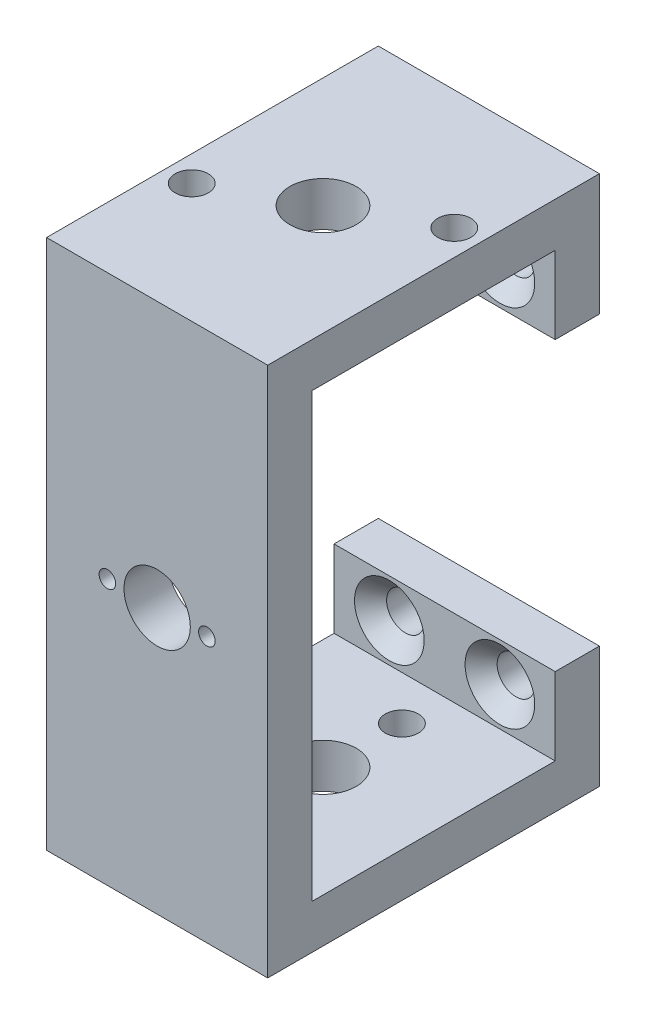
from build123d import *

# Parameters (mm, degrees)
BOSS_EXTRUDE1_DEPTH                             = 20
SKETCH2_R                                       = 3
CUT_EXTRUDE1_DEPTH                              = 48.244047244
SKETCH3_R                                       = 3
CUT_EXTRUDE2_DEPTH                              = 55.120236511
SKETCH4_W                                       = 4
SKETCH4_H                                       = 3
CUT_EXTRUDE3_DEPTH                              = 43.201895692
CUT_EXTRUDE4_REACH                              = 56.12
SKETCH5_R                                       = 1.5
CUT_EXTRUDE5_REACH                              = 56.12
SKETCH6_R                                       = 1.5
CUT_EXTRUDE6_REACH                              = 51.558
SKETCH7_R                                       = 1.5
CSK_FOR_M3_FLAT_HEAD_MACHINE_SCREW1_D           = 3.4
CSK_FOR_M3_FLAT_HEAD_MACHINE_SCREW1_DEPTH       = 4
CSK_FOR_M3_FLAT_HEAD_MACHINE_SCREW1_CSINK_D     = 6.3
CSK_FOR_M3_FLAT_HEAD_MACHINE_SCREW1_CSINK_ANGLE = 90
SKETCH9_R                                       = 0.75
CUT_EXTRUDE7_DEPTH                              = 50.558046773


with BuildPart() as part:
    # Sketch1 → Boss-Extrude1 (new body)
    with BuildSketch(Plane(origin=(0, 0, 0), x_dir=(0, 0, -1), z_dir=(1, 0, 0))):
        Polygon((-15, 0), (-15, 14), (15, 14), (15, 0), (11, 0), (11, 10), (-11, 10), (-11, 0), (-11, -30), (11, -30), (11, -20), (15, -20), (15, -34), (-15, -34), (-15, -20), align=None)
    extrude(amount=BOSS_EXTRUDE1_DEPTH)

    # Sketch2 → Cut-Extrude1 (cut, through all)
    with BuildSketch(Plane(origin=(0, 0, 11), x_dir=(-1, 0, 0), z_dir=(0, 0, -1))):
        with Locations(Location((-10, -10, 0), (0, 0, 90))):
            Circle(SKETCH2_R)
    extrude(amount=-CUT_EXTRUDE1_DEPTH, mode=Mode.SUBTRACT)

    # Sketch3 → Cut-Extrude2 (cut, through all)
    with BuildSketch(Plane(origin=(0, 14, 0), x_dir=(1, 0, 0), z_dir=(0, 1, 0))):
        with Locations(Location((10, 0, 0), (0, 0, 270))):
            Circle(SKETCH3_R)
    extrude(amount=-CUT_EXTRUDE2_DEPTH, mode=Mode.SUBTRACT)

    # Sketch4 → Cut-Extrude3 (cut, through all)
    with BuildSketch(Plane(origin=(20, 0, 0), x_dir=(0, 0, -1), z_dir=(1, 0, 0))):
        with Locations((13, 1.5)):
            Rectangle(SKETCH4_W, SKETCH4_H)
        with Locations((13, -21.5)):
            Rectangle(SKETCH4_W, SKETCH4_H)
    extrude(amount=-CUT_EXTRUDE3_DEPTH, mode=Mode.SUBTRACT)

    # Sketch5 → Cut-Extrude4 (cut, up to next)
    with BuildSketch(Plane.XZ.offset(34), mode=Mode.PRIVATE) as cut_extrude4_sk1:
        with Locations(Location((9.864597697, 6.998690322, 0), (0, 0, 270))):
            Circle(SKETCH5_R)
    cut_extrude4_tool1 = extrude(cut_extrude4_sk1.sketch, amount=-CUT_EXTRUDE4_REACH, mode=Mode.PRIVATE) & part.part
    # Sketch5 → Cut-Extrude4 (cut, up to next)
    with BuildSketch(Plane.XZ.offset(34), mode=Mode.PRIVATE) as cut_extrude4_sk2:
        with Locations(Location((10.135402303, -6.998690322, 0), (0, 0, 270))):
            Circle(SKETCH5_R)
    cut_extrude4_tool2 = extrude(cut_extrude4_sk2.sketch, amount=-CUT_EXTRUDE4_REACH, mode=Mode.PRIVATE) & part.part
    add(cut_extrude4_tool1.solids().sort_by_distance((9.864598, -34, 6.99869))[0], mode=Mode.SUBTRACT)
    add(cut_extrude4_tool2.solids().sort_by_distance((10.135402, -34, -6.99869))[0], mode=Mode.SUBTRACT)

    # Sketch6 → Cut-Extrude5 (cut, up to next)
    with BuildSketch(Plane(origin=(0, 14, 0), x_dir=(1, 0, 0), z_dir=(0, 1, 0)), mode=Mode.PRIVATE) as cut_extrude5_sk1:
        with Locations(Location((17.679589652, 4.193614525, 0), (0, 0, 270))):
            Circle(SKETCH6_R)
    cut_extrude5_tool1 = extrude(cut_extrude5_sk1.sketch, amount=-CUT_EXTRUDE5_REACH, mode=Mode.PRIVATE) & part.part
    # Sketch6 → Cut-Extrude5 (cut, up to next)
    with BuildSketch(Plane(origin=(0, 14, 0), x_dir=(1, 0, 0), z_dir=(0, 1, 0)), mode=Mode.PRIVATE) as cut_extrude5_sk2:
        with Locations(Location((2.320410348, -4.193614525, 0), (0, 0, 270))):
            Circle(SKETCH6_R)
    cut_extrude5_tool2 = extrude(cut_extrude5_sk2.sketch, amount=-CUT_EXTRUDE5_REACH, mode=Mode.PRIVATE) & part.part
    add(cut_extrude5_tool1.solids().sort_by_distance((17.67959, 14, -4.193615))[0], mode=Mode.SUBTRACT)
    add(cut_extrude5_tool2.solids().sort_by_distance((2.32041, 14, 4.193615))[0], mode=Mode.SUBTRACT)

    # Sketch7 → Cut-Extrude6 (cut, up to next)
    with BuildSketch(Plane(origin=(0, 0, -15), x_dir=(-1, 0, 0), z_dir=(0, 0, -1)), mode=Mode.PRIVATE) as cut_extrude6_sk1:
        with Locations((-15, 6.5)):
            Circle(SKETCH7_R)
    cut_extrude6_tool1 = extrude(cut_extrude6_sk1.sketch, amount=-CUT_EXTRUDE6_REACH, mode=Mode.PRIVATE) & part.part
    # Sketch7 → Cut-Extrude6 (cut, up to next)
    with BuildSketch(Plane(origin=(0, 0, -15), x_dir=(-1, 0, 0), z_dir=(0, 0, -1)), mode=Mode.PRIVATE) as cut_extrude6_sk2:
        with Locations((-5, 6.5)):
            Circle(SKETCH7_R)
    cut_extrude6_tool2 = extrude(cut_extrude6_sk2.sketch, amount=-CUT_EXTRUDE6_REACH, mode=Mode.PRIVATE) & part.part
    cut_extrude6_1 = cut_extrude6_tool1.solids().sort_by_distance((15, 6.5, -15))[0]
    add(cut_extrude6_1, mode=Mode.SUBTRACT)
    cut_extrude6_2 = cut_extrude6_tool2.solids().sort_by_distance((5, 6.5, -15))[0]
    add(cut_extrude6_2, mode=Mode.SUBTRACT)
    cut_extrude6 = cut_extrude6_1 + cut_extrude6_2  # Cut-Extrude6 as one shape, for the pattern or mirror that repeats it

    # CSK for M3 Flat Head Machine Screw1
    with Locations(Plane(origin=(5, 6.5, -11), x_dir=(0, 1, 0), z_dir=(0, 0, 1))):
        with Locations((0, 0), (0, -10)):
            csk_for_m3_flat_head_machine_screw1 = CounterSinkHole(CSK_FOR_M3_FLAT_HEAD_MACHINE_SCREW1_D / 2, CSK_FOR_M3_FLAT_HEAD_MACHINE_SCREW1_CSINK_D / 2, depth=CSK_FOR_M3_FLAT_HEAD_MACHINE_SCREW1_DEPTH, counter_sink_angle=CSK_FOR_M3_FLAT_HEAD_MACHINE_SCREW1_CSINK_ANGLE)

    # Mirror1: Cut-Extrude6, CSK for M3 Flat Head Machine Screw1 across plane
    add(cut_extrude6.mirror(Plane.ZX.offset(-10)), mode=Mode.SUBTRACT)
    add(csk_for_m3_flat_head_machine_screw1.mirror(Plane.ZX.offset(-10)), mode=Mode.SUBTRACT)

    # Sketch9 → Cut-Extrude7 (cut, through all)
    with BuildSketch(Plane.XY.offset(15)):
        with Locations((5.5, -10)):
            Circle(SKETCH9_R)
        with Locations((14.5, -10)):
            Circle(SKETCH9_R)
    extrude(amount=-CUT_EXTRUDE7_DEPTH, mode=Mode.SUBTRACT)


solid = part.part
